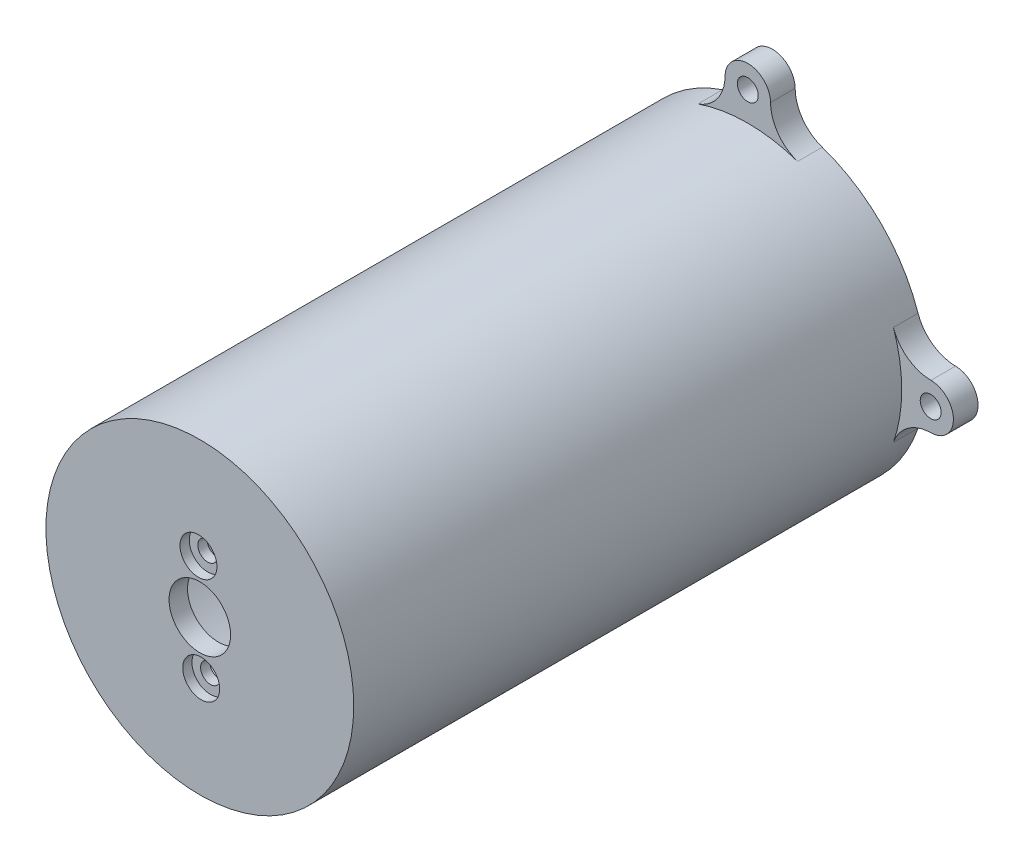
from build123d import *

# Parameters (mm, degrees)
SKETCH1_R           = 25
SKETCH1_R_2         = 24
BOSS_EXTRUDE1_DEPTH = 90
SKETCH2_R           = 25
SKETCH2_R_2         = 5
SKETCH2_R_3         = 1.6
BOSS_EXTRUDE2_DEPTH = 3
SKETCH3_R           = 3
CUT_EXTRUDE1_DEPTH  = 1.5
SKETCH4_R           = 1.7
SKETCH4_R_2         = 24
BOSS_EXTRUDE3_DEPTH = 4


with BuildPart() as part:
    # Sketch1 → Boss-Extrude1 (new body)
    with BuildSketch(Plane(origin=(0, 0, 0), x_dir=(0, 1, 0), z_dir=(0, 0, 1))):
        with Locations(Location((0, 0, 0), (0, 0, 90))):
            Circle(SKETCH1_R)
        with Locations(Location((0, 0, 0), (0, 0, 90))):
            Circle(SKETCH1_R_2, mode=Mode.SUBTRACT)
    extrude(amount=BOSS_EXTRUDE1_DEPTH)

    # Sketch2 → Boss-Extrude2 (add)
    with BuildSketch(Plane(origin=(90, 0, 90), x_dir=(0, 1, 0), z_dir=(0, 0, 1))):
        with Locations(Location((0, 90, 0), (0, 0, 90))):
            Circle(SKETCH2_R)
        with Locations(Location((0, 90, 0), (0, 0, 270))):
            Circle(SKETCH2_R_2, mode=Mode.SUBTRACT)
        with Locations(Location((-8.497096587, 89.777852327, 0), (0, 0, 270))):
            Circle(SKETCH2_R_3, mode=Mode.SUBTRACT)
        with Locations(Location((8.497096587, 90.222147673, 0), (0, 0, 270))):
            Circle(SKETCH2_R_3, mode=Mode.SUBTRACT)
    extrude(amount=BOSS_EXTRUDE2_DEPTH)

    # Sketch3 → Cut-Extrude1 (cut)
    with BuildSketch(Plane.XY.offset(93)):
        with Locations((-0.222147673, 8.497096587)):
            Circle(SKETCH3_R)
        with Locations((0.222147673, -8.497096587)):
            Circle(SKETCH3_R)
    extrude(amount=-CUT_EXTRUDE1_DEPTH, mode=Mode.SUBTRACT)

    # Sketch4 → Boss-Extrude3 (add)
    with BuildSketch(Plane(origin=(0, 0, 0), x_dir=(1, 0, 0), z_dir=(0, 0, -1))):
        with BuildLine():
            ThreePointArc((-8.088357722, 23.655410995), (-17.67766953, 17.67766953), (-23.655410995, 8.088357722))
            ThreePointArc((-23.655410995, 8.088357722), (-25.999890745, 4.92208801), (-29.742595978, 3.6916382))
            ThreePointArc((-29.742595978, 3.6916382), (-33.398500606, 0), (-29.742595978, -3.6916382))
            ThreePointArc((-29.742595978, -3.6916382), (-25.999890745, -4.92208801), (-23.655410995, -8.088357722))
            ThreePointArc((-23.655410995, -8.088357722), (-17.67766953, -17.67766953), (-8.088357722, -23.655410995))
            ThreePointArc((-8.088357722, -23.655410995), (-4.92208801, -25.999890745), (-3.6916382, -29.742595978))
            ThreePointArc((-3.6916382, -29.742595978), (0, -33.398500606), (3.6916382, -29.742595978))
            ThreePointArc((3.6916382, -29.742595978), (4.92208801, -25.999890745), (8.088357722, -23.655410995))
            ThreePointArc((8.088357722, -23.655410995), (17.67766953, -17.67766953), (23.655410995, -8.088357722))
            ThreePointArc((23.655410995, -8.088357722), (25.999890745, -4.92208801), (29.742595978, -3.6916382))
            ThreePointArc((29.742595978, -3.6916382), (33.398500606, 0), (29.742595978, 3.6916382))
            ThreePointArc((29.742595978, 3.6916382), (25.999890745, 4.92208801), (23.655410995, 8.088357722))
            ThreePointArc((23.655410995, 8.088357722), (17.67766953, 17.67766953), (8.088357722, 23.655410995))
            ThreePointArc((8.088357722, 23.655410995), (4.92208801, 25.999890745), (3.6916382, 29.742595978))
            ThreePointArc((3.6916382, 29.742595978), (0, 33.398500606), (-3.6916382, 29.742595978))
            ThreePointArc((-3.6916382, 29.742595978), (-4.92208801, 25.999890745), (-8.088357722, 23.655410995))
        make_face()
        with Locations(Location((0, 29.706687772, 0), (0, 0, 180))):
            Circle(SKETCH4_R, mode=Mode.SUBTRACT)
        with Locations(Location((29.706687772, 0, 0), (0, 0, 180))):
            Circle(SKETCH4_R, mode=Mode.SUBTRACT)
        with Locations(Location((0, -29.706687772, 0), (0, 0, 180))):
            Circle(SKETCH4_R, mode=Mode.SUBTRACT)
        with Locations(Location((-29.706687772, 0, 0), (0, 0, 180))):
            Circle(SKETCH4_R, mode=Mode.SUBTRACT)
        with Locations(Location((0, 0, 0), (0, 0, 180))):
            Circle(SKETCH4_R_2, mode=Mode.SUBTRACT)
    extrude(amount=-BOSS_EXTRUDE3_DEPTH)


solid = part.part
